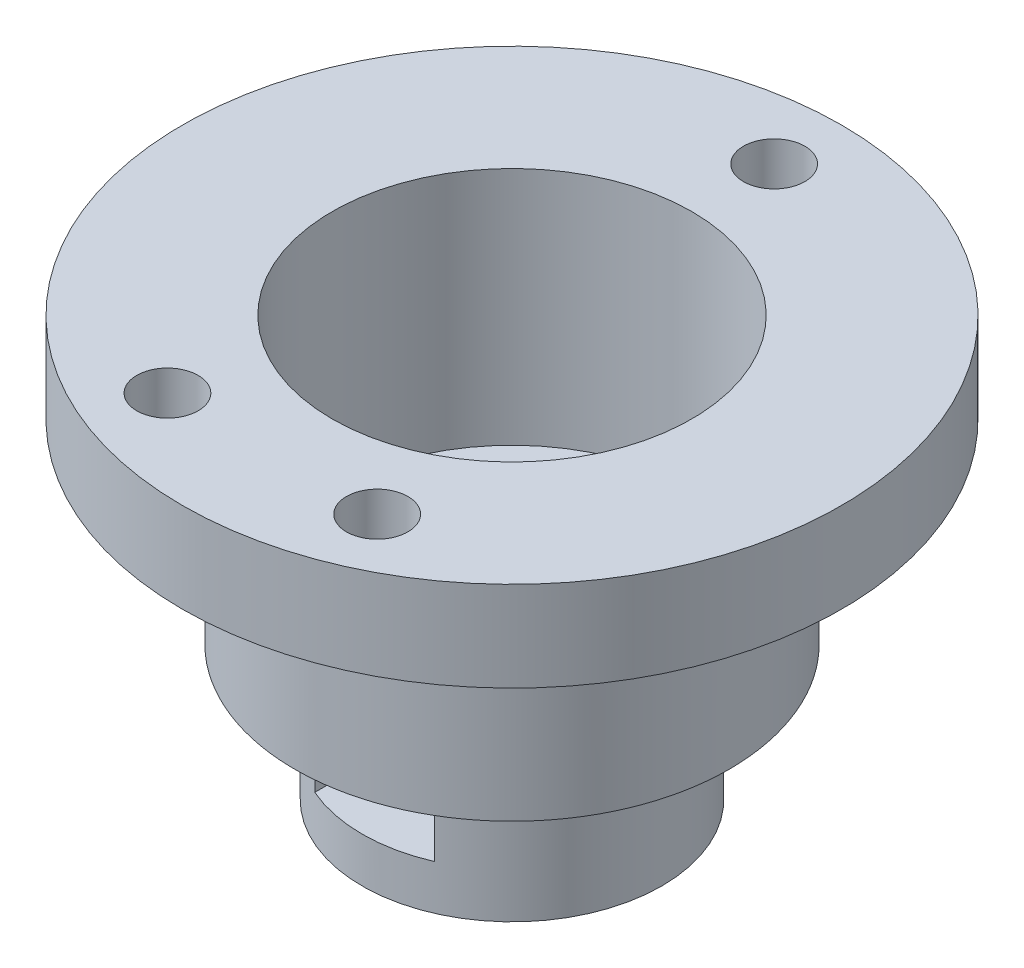
from build123d import *

# Parameters (mm, degrees)
SKETCH1_R           = 10
BOSS_EXTRUDE1_DEPTH = 9
SKETCH2_R           = 14.5
BOSS_EXTRUDE2_DEPTH = 3
SKETCH3_R           = 14.5
SKETCH3_R_2         = 12
BOSS_EXTRUDE3_DEPTH = 10
SKETCH4_R           = 3
CUT_EXTRUDE1_DEPTH  = 24.759208741
BOSS_EXTRUDE4_REACH = 32.075
SKETCH5_R           = 1.5
CUT_EXTRUDE2_DEPTH  = 3.8
SKETCH7_R           = 22
SKETCH7_R_2         = 12
BOSS_EXTRUDE5_DEPTH = 6
SKETCH8_R           = 2.05
CUT_EXTRUDE3_DEPTH  = 5


with BuildPart() as part:
    # Sketch1 → Boss-Extrude1 (new body)
    with BuildSketch(Plane(origin=(0, 0, 0), x_dir=(1, 0, 0), z_dir=(0, 1, 0))):
        with Locations(Location((0, 0, 0), (0, 0, 270))):
            Circle(SKETCH1_R)
    extrude(amount=BOSS_EXTRUDE1_DEPTH)

    # Sketch2 → Boss-Extrude2 (add)
    with BuildSketch(Plane(origin=(0, 9, 0), x_dir=(1, 0, 0), z_dir=(0, 1, 0))):
        with Locations(Location((0, 0, 0), (0, 0, 270))):
            Circle(SKETCH2_R)
    extrude(amount=BOSS_EXTRUDE2_DEPTH)

    # Sketch3 → Boss-Extrude3 (add)
    with BuildSketch(Plane(origin=(0, 12, 0), x_dir=(1, 0, 0), z_dir=(0, 1, 0))):
        with Locations(Location((0, 0, 0), (0, 0, 270))):
            Circle(SKETCH3_R)
        with Locations(Location((0, 0, 0), (0, 0, 270))):
            Circle(SKETCH3_R_2, mode=Mode.SUBTRACT)
    extrude(amount=BOSS_EXTRUDE3_DEPTH)

    # Sketch4 → Cut-Extrude1 (cut, through all)
    with BuildSketch(Plane(origin=(0, 12, 0), x_dir=(1, 0, 0), z_dir=(0, 1, 0))):
        with Locations(Location((0, 0, 0), (0, 0, 270))):
            Circle(SKETCH4_R)
    extrude(amount=-CUT_EXTRUDE1_DEPTH, mode=Mode.SUBTRACT)

    # Sketch5 → Boss-Extrude4 (add, up to next)
    with BuildSketch(Plane.XZ, mode=Mode.PRIVATE) as boss_extrude4_sk1:
        with Locations((-13, 0)):
            Circle(SKETCH5_R)
    boss_extrude4_tool1 = extrude(boss_extrude4_sk1.sketch, amount=-BOSS_EXTRUDE4_REACH, mode=Mode.PRIVATE) - part.part
    # Sketch5 → Boss-Extrude4 (add, up to next)
    with BuildSketch(Plane.XZ, mode=Mode.PRIVATE) as boss_extrude4_sk2:
        with BuildLine():
            ThreePointArc((-9.886859967, -1.5), (-10, 0), (-9.886859967, 1.5))
            Line((-9.886859967, 1.5), (-13, 1.5))
            ThreePointArc((-13, 1.5), (-11.939339828, 1.060660172), (-11.5, 0))
            ThreePointArc((-11.5, 0), (-11.939339828, -1.060660172), (-13, -1.5))
            Line((-13, -1.5), (-9.886859967, -1.5))
        make_face()
    boss_extrude4_tool2 = extrude(boss_extrude4_sk2.sketch, amount=-BOSS_EXTRUDE4_REACH, mode=Mode.PRIVATE) - part.part
    add(boss_extrude4_tool1.solids().sort_by_distance((-13, 0, 0))[0])
    add(boss_extrude4_tool2.solids().sort_by_distance((-10.921971, 0, 0))[0])

    # Sketch6 → Cut-Extrude2 (cut)
    with BuildSketch(Plane(origin=(0, 3, 0), x_dir=(-1, 0, 0), z_dir=(0, -1, 0))):
        with BuildLine():
            Line((4, -2.309401077), (4, 2.309401077))
            Line((4, 2.309401077), (0, 4.618802154))
            Line((0, 4.618802154), (-4, 2.309401077))
            Line((-4, 2.309401077), (-4, -2.309401077))
            Line((-4, -2.309401077), (-4, -9.16515139))
            ThreePointArc((-4, -9.16515139), (0, -10), (4, -9.16515139))
            Line((4, -9.16515139), (4, -2.309401077))
        make_face()
    extrude(amount=-CUT_EXTRUDE2_DEPTH, mode=Mode.SUBTRACT)

    # Sketch7 → Boss-Extrude5 (add)
    with BuildSketch(Plane(origin=(0, 22, 0), x_dir=(1, 0, 0), z_dir=(0, 1, 0))):
        with Locations(Location((0, 0, 0), (0, 0, 270))):
            Circle(SKETCH7_R)
        with Locations(Location((0, 0, 0), (0, 0, 270))):
            Circle(SKETCH7_R_2, mode=Mode.SUBTRACT)
    extrude(amount=BOSS_EXTRUDE5_DEPTH)

    # Sketch8 → Cut-Extrude3 (cut)
    with BuildSketch(Plane(origin=(0, 28, 0), x_dir=(1, 0, 0), z_dir=(0, 1, 0))):
        with Locations(Location((0, 17.5, 0), (0, 0, 270))):
            Circle(SKETCH8_R)
        with Locations(Location((-7, -16, 0), (0, 0, 270))):
            Circle(SKETCH8_R)
        with Locations(Location((7, -16, 0), (0, 0, 270))):
            Circle(SKETCH8_R)
    extrude(amount=-CUT_EXTRUDE3_DEPTH, mode=Mode.SUBTRACT)


solid = part.part
